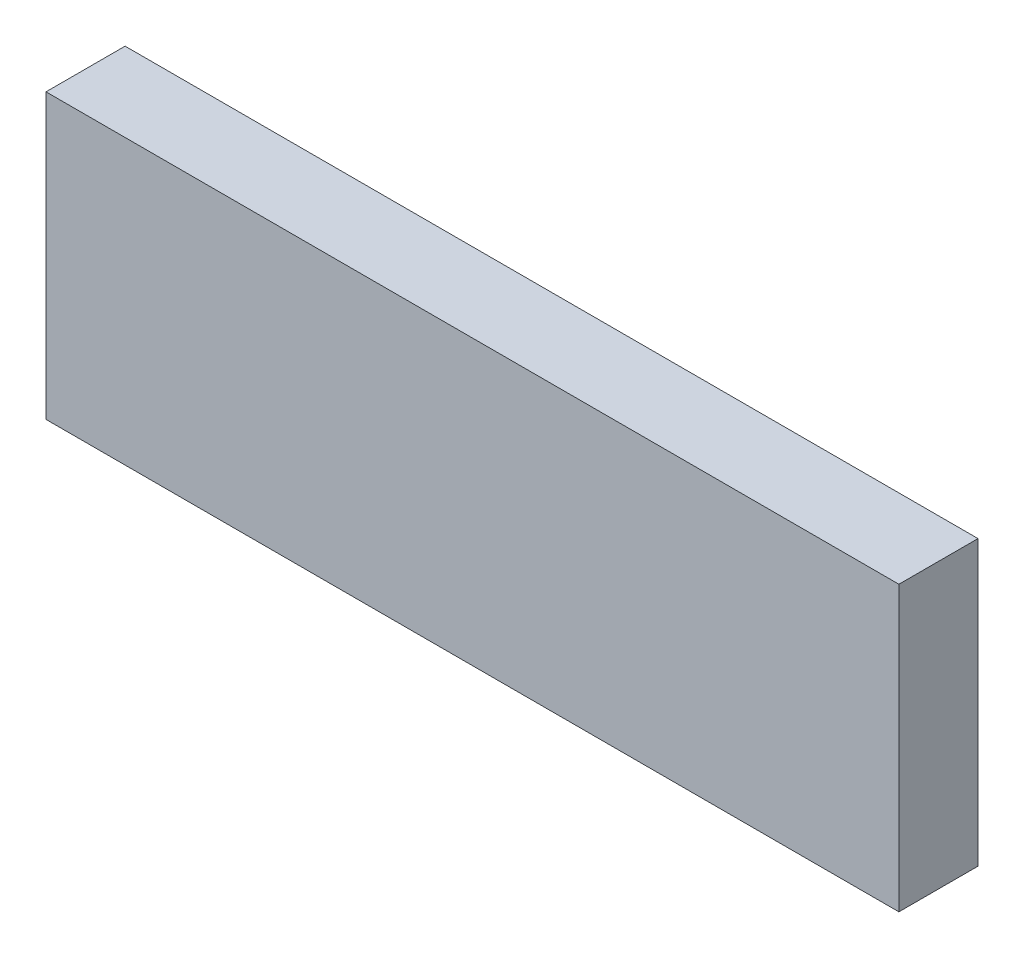
from build123d import *

# Parameters (mm, degrees)
SKETCH1_W           = 49.600000114
SKETCH1_H           = 16.50000002
BOSS_EXTRUDE1_DEPTH = 4.599999944


with BuildPart() as part:
    # Sketch1 → Boss-Extrude1 (new body)
    with BuildSketch(Plane.XY):
        with Locations((24.800000057, 8.25000001)):
            Rectangle(SKETCH1_W, SKETCH1_H)
    extrude(amount=BOSS_EXTRUDE1_DEPTH)


solid = part.part
